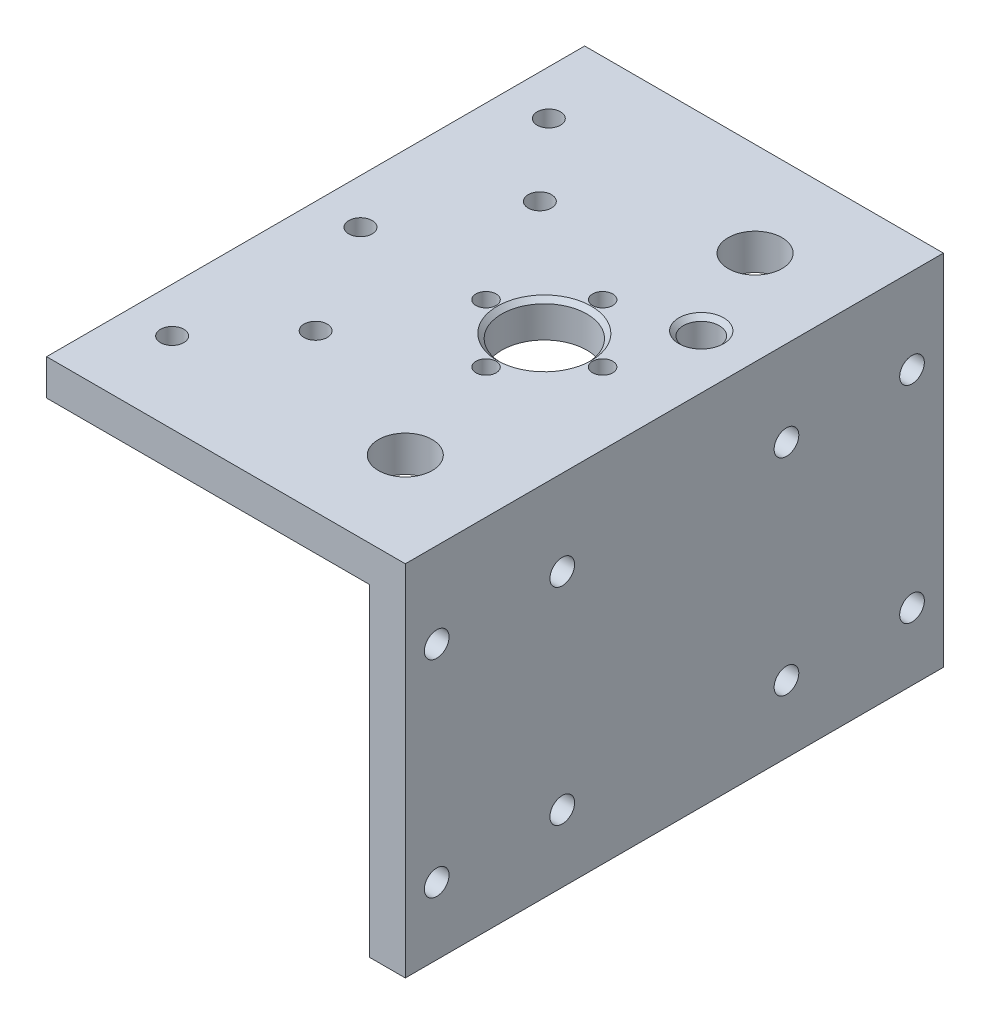
from build123d import *

# Parameters (mm, degrees)
ESTRUSIONE_ESTRUSIONE1_DEPTH = 120
TAGLIO_ESTRUSIONE2_REACH     = 166.924
SCHIZZO6_R                   = 6
TAGLIO_ESTRUSIONE3_REACH     = 166.924
SCHIZZO7_R                   = 9.5
SCHIZZO7_R_2                 = 4
FORO_PER_VITE_M4_2_D         = 4.5
SCHIZZO12_R                  = 2.75
TAGLIO_ESTRUSIONE4_DEPTH     = 10
SCHIZZO14_R                  = 2.6
TAGLIO_ESTRUSIONE5_DEPTH     = 10
SMUSSO1_SIZE                 = 1
SMUSSO2_SIZE                 = 1


with BuildPart() as part:
    # Schizzo1 → Estrusione-Estrusione1 (new body)
    with BuildSketch(Plane.XY):
        Polygon((0, 0), (-80, 0), (-80, -8), (-8, -8), (-8, -80), (0, -80), align=None)
    extrude(amount=ESTRUSIONE_ESTRUSIONE1_DEPTH)

    # Schizzo6 → Taglio-Estrusione2 (cut, up to next)
    with BuildSketch(Plane(origin=(0, 0, 0), x_dir=(1, 0, 0), z_dir=(0, 1, 0)), mode=Mode.PRIVATE) as taglio_estrusione2_sk1:
        with Locations(Location((-21, -21, 0), (0, 0, 180))):
            Circle(SCHIZZO6_R)
    taglio_estrusione2_tool1 = extrude(taglio_estrusione2_sk1.sketch, amount=-TAGLIO_ESTRUSIONE2_REACH, mode=Mode.PRIVATE) & part.part
    # Schizzo6 → Taglio-Estrusione2 (cut, up to next)
    with BuildSketch(Plane(origin=(0, 0, 0), x_dir=(1, 0, 0), z_dir=(0, 1, 0)), mode=Mode.PRIVATE) as taglio_estrusione2_sk2:
        with Locations(Location((-21, -99, 0), (0, 0, 180))):
            Circle(SCHIZZO6_R)
    taglio_estrusione2_tool2 = extrude(taglio_estrusione2_sk2.sketch, amount=-TAGLIO_ESTRUSIONE2_REACH, mode=Mode.PRIVATE) & part.part
    add(taglio_estrusione2_tool1.solids().sort_by_distance((-21, 0, 21))[0], mode=Mode.SUBTRACT)
    add(taglio_estrusione2_tool2.solids().sort_by_distance((-21, 0, 99))[0], mode=Mode.SUBTRACT)

    # Schizzo7 → Taglio-Estrusione3 (cut, up to next)
    with BuildSketch(Plane(origin=(0, 0, 0), x_dir=(1, 0, 0), z_dir=(0, 1, 0)), mode=Mode.PRIVATE) as taglio_estrusione3_sk1:
        with Locations(Location((-29, -60, 0), (0, 0, 180))):
            Circle(SCHIZZO7_R)
    taglio_estrusione3_tool1 = extrude(taglio_estrusione3_sk1.sketch, amount=-TAGLIO_ESTRUSIONE3_REACH, mode=Mode.PRIVATE) & part.part
    # Schizzo7 → Taglio-Estrusione3 (cut, up to next)
    with BuildSketch(Plane(origin=(0, 0, 0), x_dir=(1, 0, 0), z_dir=(0, 1, 0)), mode=Mode.PRIVATE) as taglio_estrusione3_sk2:
        with Locations(Location((-12, -42, 0), (0, 0, 180))):
            Circle(SCHIZZO7_R_2)
    taglio_estrusione3_tool2 = extrude(taglio_estrusione3_sk2.sketch, amount=-TAGLIO_ESTRUSIONE3_REACH, mode=Mode.PRIVATE) & part.part
    add(taglio_estrusione3_tool1.solids().sort_by_distance((-29, 0, 60))[0], mode=Mode.SUBTRACT)
    add(taglio_estrusione3_tool2.solids().sort_by_distance((-12, 0, 42))[0], mode=Mode.SUBTRACT)

    # Foro per Vite M4-2 (through all)
    with Locations(Plane(origin=(0, 0, 0), x_dir=(1, 0, 0), z_dir=(0, 1, 0))):
        with Locations((-29, -47), (-42, -60), (-29, -73), (-16, -60), (-29, -60)):
            Hole(FORO_PER_VITE_M4_2_D / 2)

    # Schizzo12 → Taglio-Estrusione4 (cut)
    with BuildSketch(Plane(origin=(0, 0, 0), x_dir=(0, 0, -1), z_dir=(1, 0, 0))):
        with Locations((-113, -19)):
            Circle(SCHIZZO12_R)
        with Locations(Location((-85, -19, 0), (0, 0, 90))):
            Circle(SCHIZZO12_R)
        with Locations((-35, -19)):
            Circle(SCHIZZO12_R)
        with Locations(Location((-7, -19, 0), (0, 0, 90))):
            Circle(SCHIZZO12_R)
        with Locations((-85, -65)):
            Circle(SCHIZZO12_R)
        with Locations(Location((-113, -65, 0), (0, 0, 90))):
            Circle(SCHIZZO12_R)
        with Locations((-7, -65)):
            Circle(SCHIZZO12_R)
        with Locations(Location((-35, -65, 0), (0, 0, 90))):
            Circle(SCHIZZO12_R)
    extrude(amount=-TAGLIO_ESTRUSIONE4_DEPTH, mode=Mode.SUBTRACT)

    # Schizzo14 → Taglio-Estrusione5 (cut)
    with BuildSketch(Plane(origin=(0, 0, 0), x_dir=(1, 0, 0), z_dir=(0, 1, 0))):
        with Locations(Location((-70, -18, 0), (0, 0, 180))):
            Circle(SCHIZZO14_R)
        with Locations(Location((-70, -60, 0), (0, 0, 180))):
            Circle(SCHIZZO14_R)
        with Locations(Location((-70, -102, 0), (0, 0, 180))):
            Circle(SCHIZZO14_R)
        with Locations(Location((-55, -35, 0), (0, 0, 180))):
            Circle(SCHIZZO14_R)
        with Locations(Location((-55, -85, 0), (0, 0, 180))):
            Circle(SCHIZZO14_R)
    extrude(amount=-TAGLIO_ESTRUSIONE5_DEPTH, mode=Mode.SUBTRACT)

    # Smusso1
    smusso1_edges = [part.edges().sort_by_distance(p)[0] for p in [
        (-8, 0, 42),
    ]]
    chamfer(smusso1_edges, length=SMUSSO1_SIZE)

    # Smusso2
    smusso2_edges = [part.edges().sort_by_distance(p)[0] for p in [
        (-19.5, 0, 60),
    ]]
    chamfer(smusso2_edges, length=SMUSSO2_SIZE)


solid = part.part
